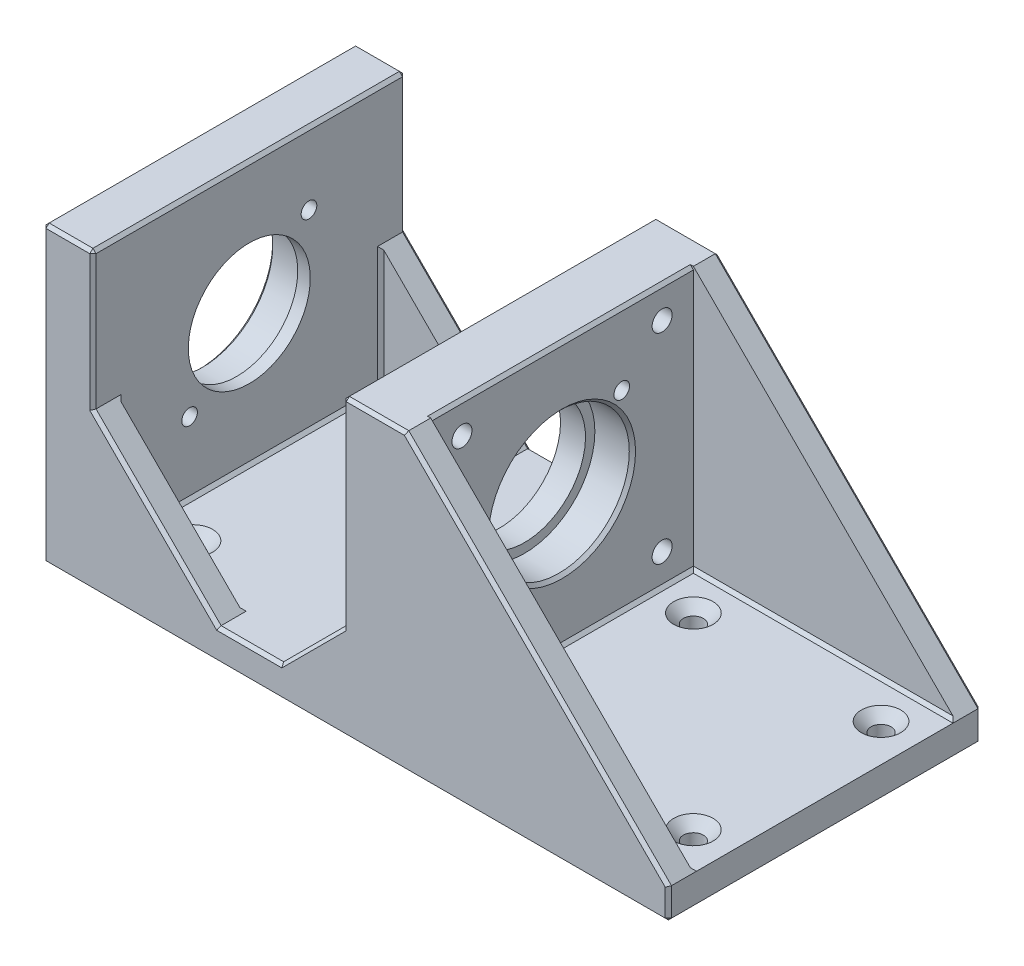
from build123d import *

# Parameters (mm, degrees)
BOSS_EXTRUDE1_DEPTH                             = 25
CUT_EXTRUDE1_DEPTH                              = 21
CUT_EXTRUDE1_DEPTH_BACK                         = 21
SKETCH2_W                                       = 40
SKETCH2_H                                       = 42
CUT_EXTRUDE2_DEPTH                              = 69.300805266
CUT_EXTRUDE2_DEPTH_BACK                         = 69.300805266
SKETCH3_R                                       = 11.25
SKETCH4_R                                       = 11.25
SKETCH4_R_2                                     = 9.75
BOSS_EXTRUDE2_DEPTH                             = 2
TAP_DRILL_FOR_M3X0_5_TAP1_D                     = 2.5
CSK_FOR_M3_FLAT_HEAD_MACHINE_SCREW1_D           = 3.2
CSK_FOR_M3_FLAT_HEAD_MACHINE_SCREW1_DEPTH       = 10
CSK_FOR_M3_FLAT_HEAD_MACHINE_SCREW1_CSINK_D     = 6.3
CSK_FOR_M3_FLAT_HEAD_MACHINE_SCREW1_CSINK_ANGLE = 90
CSK_FOR_M3_FLAT_HEAD_MACHINE_SCREW2_D           = 3.2
CSK_FOR_M3_FLAT_HEAD_MACHINE_SCREW2_CSINK_D     = 6.3
CSK_FOR_M3_FLAT_HEAD_MACHINE_SCREW2_CSINK_ANGLE = 90
CHAMFER1_SIZE                                   = 0.5
BOSS_EXTRUDE3_START                             = -44
SKETCH4_2_R                                     = 11.25
SKETCH4_2_R_2                                   = 9.75
BOSS_EXTRUDE3_DEPTH                             = 4


with BuildPart() as part:
    # Sketch1 → Boss-Extrude1 (new, symmetric)
    with BuildSketch(Plane.XY):
        Polygon((-10, 21), (-10, -11), (-20, -21), (-30, -21), (-50, -1), (-50, 21), (-58, 21), (-58, -26), (42, -26), (42, -21), (0, 21), align=None)
    extrude(amount=BOSS_EXTRUDE1_DEPTH, both=True)

    # Sketch2 → Cut-Extrude1 (cut, two sides: drawn at the far end of the back side and taken through both)
    with BuildSketch(Plane.XY.offset(-CUT_EXTRUDE1_DEPTH_BACK)):
        with Locations((-30, 0)):
            Rectangle(SKETCH2_W, SKETCH2_H)
        Polygon((0, 21), (0, -21), (42, -21), align=None)
    extrude(amount=CUT_EXTRUDE1_DEPTH + CUT_EXTRUDE1_DEPTH_BACK, mode=Mode.SUBTRACT)

    # Sketch3 → Cut-Extrude2 (cut, two sides: drawn at the far end of the back side and taken through both)
    with BuildSketch(Plane(origin=(0, 0, 0), x_dir=(0, 0, -1), z_dir=(1, 0, 0)).offset(-CUT_EXTRUDE2_DEPTH_BACK)):
        Circle(SKETCH3_R)
    extrude(amount=CUT_EXTRUDE2_DEPTH + CUT_EXTRUDE2_DEPTH_BACK, mode=Mode.SUBTRACT)

    # Sketch4 → Boss-Extrude2 (add)
    with BuildSketch(Plane.ZY.offset(50)):
        with Locations(Location((0, 0, 0), (0, 0, 180))):
            Circle(SKETCH4_R)
        with Locations(Location((0, 0, 0), (0, 0, 270))):
            Circle(SKETCH4_R_2, mode=Mode.SUBTRACT)
    extrude(amount=BOSS_EXTRUDE2_DEPTH)

    # Tap Drill for M3x0.5 Tap1 (through all)
    with Locations(Plane.ZY.offset(58)):
        with Locations((-9.545941546, 9.545941546), (9.545941546, -9.545941546)):
            Hole(TAP_DRILL_FOR_M3X0_5_TAP1_D / 2)

    # CSK for M3 Flat Head Machine Screw1
    with Locations(Plane.ZY.offset(10)):
        with Locations((-16, 16), (16, 16), (16, -16), (-16, -16), (0, 0)):
            CounterSinkHole(CSK_FOR_M3_FLAT_HEAD_MACHINE_SCREW1_D / 2, CSK_FOR_M3_FLAT_HEAD_MACHINE_SCREW1_CSINK_D / 2, depth=CSK_FOR_M3_FLAT_HEAD_MACHINE_SCREW1_DEPTH, counter_sink_angle=CSK_FOR_M3_FLAT_HEAD_MACHINE_SCREW1_CSINK_ANGLE)

    # CSK for M3 Flat Head Machine Screw2 (through all)
    with Locations(Plane(origin=(0, -21, 0), x_dir=(1, 0, 0), z_dir=(0, 1, 0))):
        with Locations((-44, 15), (-16, 15), (36, 15), (36, -15), (-16, -15), (-44, -15), (6, -15), (6, 15)):
            CounterSinkHole(CSK_FOR_M3_FLAT_HEAD_MACHINE_SCREW2_D / 2, CSK_FOR_M3_FLAT_HEAD_MACHINE_SCREW2_CSINK_D / 2, counter_sink_angle=CSK_FOR_M3_FLAT_HEAD_MACHINE_SCREW2_CSINK_ANGLE)

    # Chamfer1
    chamfer1_edges = [part.edges().sort_by_distance(p)[0] for p in [
        (0, 0, 11.25),
        (-58, 0, 11.25),
        (-10, -16, -21),
        (-10, -16, 21),
        (-15, -21, 21),
        (-10, -21, 0),
        (-15, -21, -21),
        (-50, -11, 21),
        (-50, -11, -21),
        (-40, -21, -21),
        (-50, -21, 0),
        (-40, -21, 21),
        (21, -21, 21),
        (0, -21, 0),
        (21, -21, -21),
        (0, 21, 0),
        (-10, 21, 0),
        (-5, 21, 25),
        (-10, 5, 25),
        (-15, -16, 25),
        (-25, -21, 25),
        (-40, -11, 25),
        (-50, 10, 25),
        (-54, 21, 25),
        (-50, 21, 0),
        (-58, 21, 0),
        (-54, 21, -25),
        (-50, 10, -25),
        (-40, -11, -25),
        (-25, -21, -25),
        (-15, -16, -25),
        (-10, 5, -25),
        (-5, 21, -25),
        (21, 0, 25),
        (21, 0, -25),
        (42, -23.5, 25),
        (42, -23.5, -25),
        (-58, -2.5, -25),
        (-58, -2.5, 25),
        (42, -26, 0),
        (-8, -26, -25),
        (-58, -26, 0),
        (-8, -26, 25),
    ]]
    chamfer(chamfer1_edges, length=CHAMFER1_SIZE)

    # Sketch4<2> → Boss-Extrude3 (add)
    with BuildSketch(Plane.ZY.offset(50).offset(BOSS_EXTRUDE3_START)):
        with Locations(Location((0, 0, 0), (0, 0, 180))):
            Circle(SKETCH4_2_R)
        with Locations(Location((0, 0, 0), (0, 0, 270))):
            Circle(SKETCH4_2_R_2, mode=Mode.SUBTRACT)
    extrude(amount=BOSS_EXTRUDE3_DEPTH)


solid = part.part
